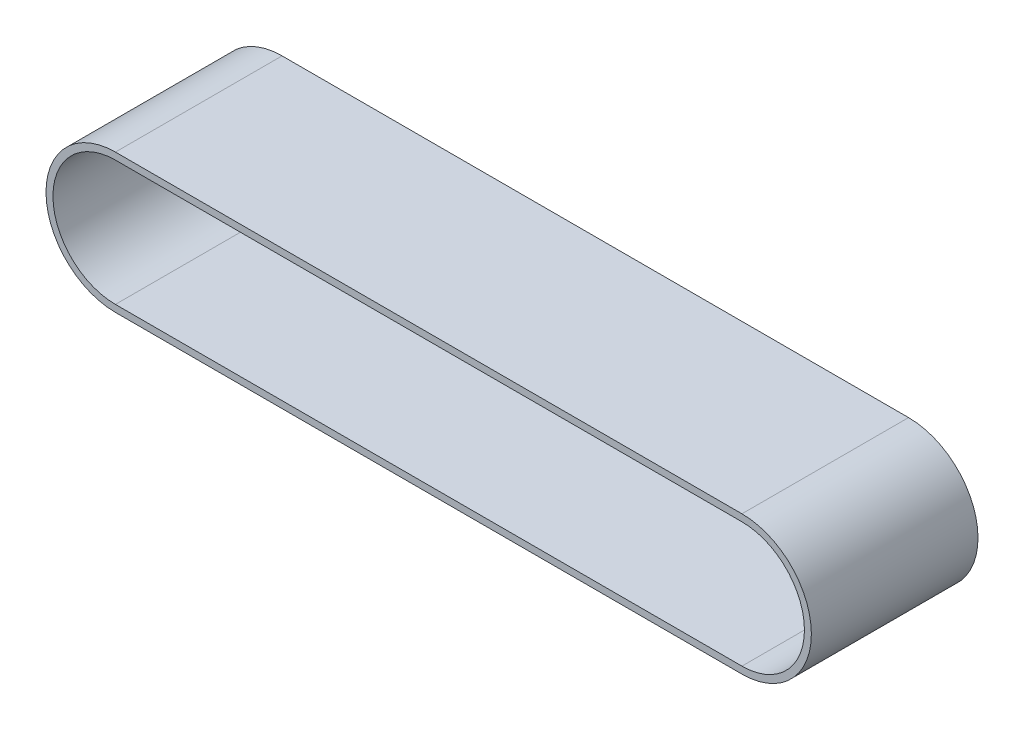
from build123d import *

# Parameters (mm, degrees)
BOSS_EXTRUDE2_DEPTH = 152.4


with BuildPart() as part:
    # Sketch2 → Boss-Extrude2 (new body)
    with BuildSketch(Plane.XY):
        with BuildLine():
            Line((-286.5, 63.5), (286.5, 63.5))
            ThreePointArc((286.5, 63.5), (350, 0), (286.5, -63.5))
            Line((286.5, -63.5), (-286.5, -63.5))
            ThreePointArc((-286.5, -63.5), (-350, 0), (-286.5, 63.5))
        make_face()
        with BuildLine():
            Line((-286.5, 57.15), (286.5, 57.15))
            ThreePointArc((286.5, 57.15), (343.65, 0), (286.5, -57.15))
            Line((286.5, -57.15), (-286.5, -57.15))
            ThreePointArc((-286.5, -57.15), (-343.65, 0), (-286.5, 57.15))
        make_face(mode=Mode.SUBTRACT)
    extrude(amount=BOSS_EXTRUDE2_DEPTH)


solid = part.part
